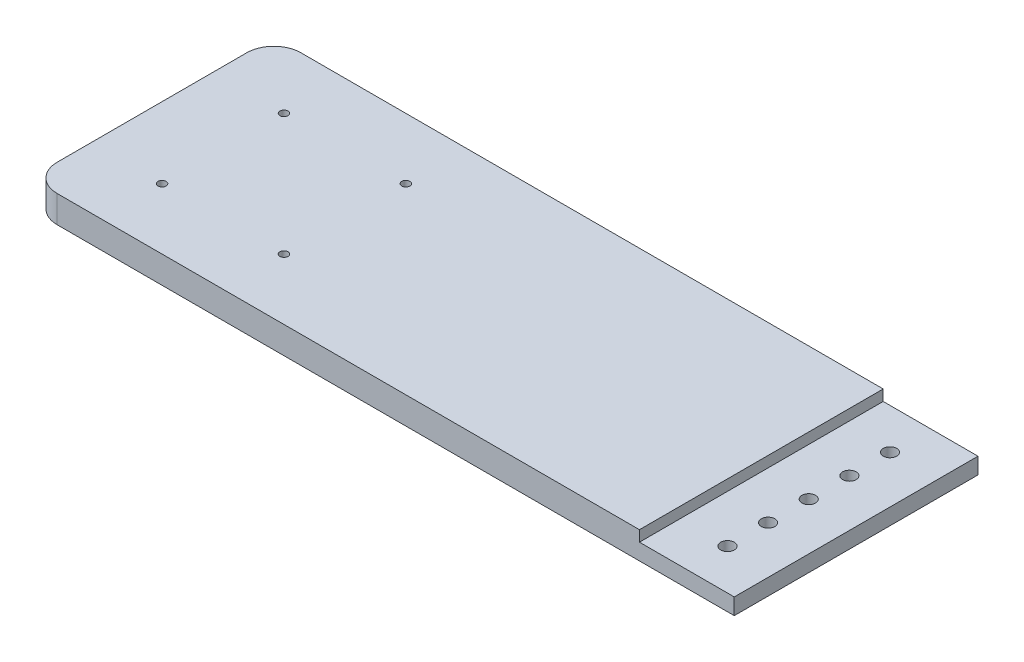
from build123d import *

# Parameters (mm, degrees)
SKETCH_1_W          = 260
SKETCH_1_H          = 90
EXTRUDE_1_DEPTH     = 10
SKETCH_2_W          = 35
SKETCH_2_H          = 90
CUT_EXTRUDE_1_DEPTH = 4
SKETCH_3_R          = 1.5
CUT_EXTRUDE_2_DEPTH = 10
CUT_EXTRUDE_START   = -5
SKETCH_4_R          = 3.5
SKETCH_4_R_2        = 1.5
CUT_EXTRUDE_3_DEPTH = 5
SKETCH_5_R          = 2.5
CUT_EXTRUDE_4_DEPTH = 25
FILLET_1_R          = 10


with BuildPart() as part:
    # 草图1 → 凸台-拉伸1 (new body)
    with BuildSketch(Plane(origin=(0, 0, 0), x_dir=(1, 0, 0), z_dir=(0, 1, 0))):
        with Locations((130, -45)):
            Rectangle(SKETCH_1_W, SKETCH_1_H)
    extrude(amount=EXTRUDE_1_DEPTH)

    # 草图2 → 切除-拉伸1 (cut)
    with BuildSketch(Plane(origin=(0, 10, 0), x_dir=(1, 0, 0), z_dir=(0, 1, 0))):
        with Locations((242.5, -45)):
            Rectangle(SKETCH_2_W, SKETCH_2_H)
    extrude(amount=-CUT_EXTRUDE_1_DEPTH, mode=Mode.SUBTRACT)

    # 草图3 → 切除-拉伸2 (cut)
    with BuildSketch(Plane(origin=(0, 10, 0), x_dir=(1, 0, 0), z_dir=(0, 1, 0))):
        with Locations(Location((26.239488698, -22.5, 0), (0, 0, 270))):
            Circle(SKETCH_3_R)
        with Locations(Location((26.239488698, -67.5, 0), (0, 0, 270))):
            Circle(SKETCH_3_R)
        with Locations(Location((71.239488698, -67.5, 0), (0, 0, 270))):
            Circle(SKETCH_3_R)
        with Locations(Location((71.239488698, -22.5, 0), (0, 0, 270))):
            Circle(SKETCH_3_R)
    extrude(amount=-CUT_EXTRUDE_2_DEPTH, mode=Mode.SUBTRACT)

    # 草图4 → 切除-拉伸3 (cut)
    # profile 1 of 4: a face of its own
    with BuildSketch(Plane.XZ.offset(CUT_EXTRUDE_START)):
        with Locations(Location((26.239488698, 67.5, 0), (0, 0, 270))):
            Circle(SKETCH_4_R)
        with Locations(Location((26.239488698, 67.5, 0), (0, 0, 90))):
            Circle(SKETCH_4_R_2, mode=Mode.SUBTRACT)
    # profile 2 of 4: a face of its own
    with BuildSketch(Plane.XZ.offset(CUT_EXTRUDE_START)):
        with Locations(Location((26.239488698, 22.5, 0), (0, 0, 270))):
            Circle(SKETCH_4_R)
        with Locations(Location((26.239488698, 22.5, 0), (0, 0, 90))):
            Circle(SKETCH_4_R_2, mode=Mode.SUBTRACT)
    # profile 3 of 4: a face of its own
    with BuildSketch(Plane.XZ.offset(CUT_EXTRUDE_START)):
        with Locations(Location((71.239488698, 22.5, 0), (0, 0, 270))):
            Circle(SKETCH_4_R)
        with Locations(Location((71.239488698, 22.5, 0), (0, 0, 90))):
            Circle(SKETCH_4_R_2, mode=Mode.SUBTRACT)
    # profile 4 of 4: a face of its own
    with BuildSketch(Plane.XZ.offset(CUT_EXTRUDE_START)):
        with Locations(Location((71.239488698, 67.5, 0), (0, 0, 270))):
            Circle(SKETCH_4_R)
        with Locations(Location((71.239488698, 67.5, 0), (0, 0, 90))):
            Circle(SKETCH_4_R_2, mode=Mode.SUBTRACT)
    extrude(amount=CUT_EXTRUDE_3_DEPTH, mode=Mode.SUBTRACT)

    # 草图5 → 切除-拉伸4 (cut)
    with BuildSketch(Plane(origin=(0, 6, 0), x_dir=(1, 0, 0), z_dir=(0, 1, 0))):
        with Locations(Location((242.5, -45, 0), (0, 0, 270))):
            Circle(SKETCH_5_R)
        with Locations(Location((242.5, -15, 0), (0, 0, 270))):
            Circle(SKETCH_5_R)
        with Locations(Location((242.5, -75, 0), (0, 0, 270))):
            Circle(SKETCH_5_R)
        with Locations(Location((242.5, -30, 0), (0, 0, 270))):
            Circle(SKETCH_5_R)
        with Locations(Location((242.5, -60, 0), (0, 0, 270))):
            Circle(SKETCH_5_R)
    extrude(amount=-CUT_EXTRUDE_4_DEPTH, mode=Mode.SUBTRACT)

    # 圆角1
    fillet_1_edges = [part.edges().sort_by_distance(p)[0] for p in [
        (0, 5, 0),
        (0, 5, 90),
    ]]
    fillet(fillet_1_edges, radius=FILLET_1_R)


solid = part.part
